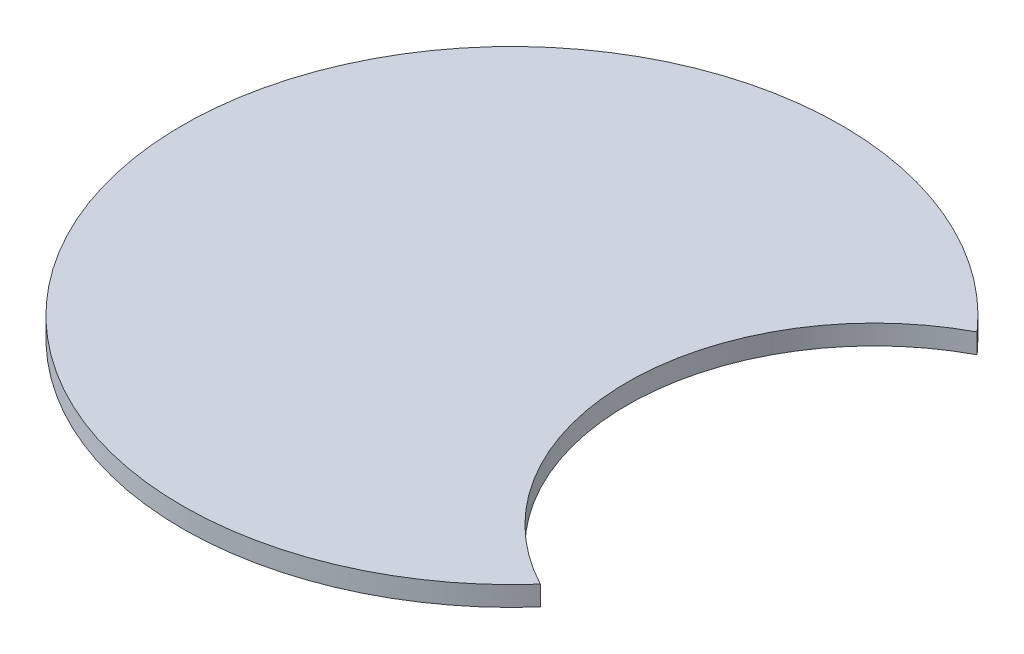
from build123d import *

# Parameters (mm, degrees)
BOSS_EXTRUDE1_DEPTH = 3


with BuildPart() as part:
    # Sketch1 → Boss-Extrude1 (new body)
    with BuildSketch(Plane(origin=(0, 0, 0), x_dir=(1, 0, 0), z_dir=(0, 1, 0))):
        with BuildLine():
            ThreePointArc((37.443181818, 33.136205808), (-50, 0), (37.443181818, -33.136205808))
            ThreePointArc((37.443181818, -33.136205808), (17.5, 0), (37.443181818, 33.136205808))
        make_face()
    extrude(amount=BOSS_EXTRUDE1_DEPTH)


solid = part.part
